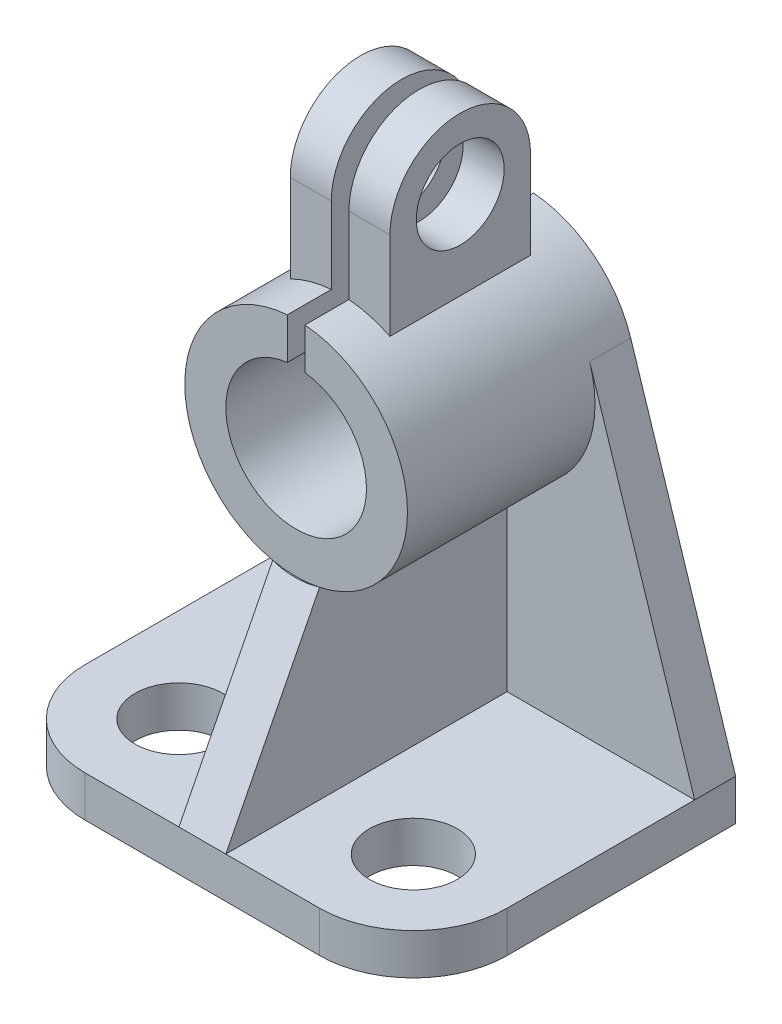
from build123d import *

# Parameters (mm, degrees)
SKETCH1_W                  = 72
SKETCH1_H                  = 7
BOSS_EXTRUDE1_DEPTH        = 55
BOSS_EXTRUDE2_DEPTH        = 7
BOSS_EXTRUDE3_DEPTH        = 39
BOSS_EXTRUDE4_START        = 7.5
BOSS_EXTRUDE4_DEPTH        = 24
BOSS_EXTRUDE5_DEPTH        = 55
FILLET3_RADIUS             = 12
FILLET3_LENGTH             = 7
FILLET4_RADIUS             = 12
FILLET4_LENGTH             = 7
CUT_EXTRUDE1_DEPTH         = 55
F_12_0MM_DOWEL_HOLE1_D     = 15
F_12_0MM_DOWEL_HOLE1_DEPTH = 30
F_12_0MM_DOWEL_HOLE1_TIP   = 4.506454643
FILLET5_R                  = 16
F_12_0MM_DOWEL_HOLE2_D     = 15
F_12_0MM_DOWEL_HOLE2_DEPTH = 30
F_12_0MM_DOWEL_HOLE2_TIP   = 4.506454643


with BuildPart() as part:
    # Sketch1 → Boss-Extrude1 (new body)
    with BuildSketch(Plane.XY):
        with Locations((0, 3.5)):
            Rectangle(SKETCH1_W, SKETCH1_H)
    extrude(amount=BOSS_EXTRUDE1_DEPTH)

    # Sketch1<3> → Boss-Extrude2 (add)
    with BuildSketch(Plane.XY):
        with BuildLine():
            Line((36, 7), (18.091261695, 62.805708421))
            ThreePointArc((18.091261695, 62.805708421), (16.449943687, 47.492142581), (4, 38.425824379))
            Line((4, 38.425824379), (4, 7))
            Line((4, 7), (36, 7))
        make_face()
        with BuildLine():
            ThreePointArc((-4, 38.425824379), (-16.449943687, 47.492142581), (-18.091261695, 62.805708421))
            Line((-18.091261695, 62.805708421), (-36, 7))
            Line((-36, 7), (-4, 7))
            Line((-4, 7), (-4, 38.425824379))
        make_face()
    extrude(amount=BOSS_EXTRUDE2_DEPTH)

    # Sketch1<4> → Boss-Extrude3 (add)
    with BuildSketch(Plane.XY):
        with BuildLine():
            ThreePointArc((-1.5, 68.9058809), (0, 45), (1.5, 68.9058809))
            Line((1.5, 68.9058809), (1.5, 75.940696925))
            ThreePointArc((1.5, 75.940696925), (0, 38), (-1.5, 75.940696925))
            Line((-1.5, 75.940696925), (-1.5, 68.9058809))
        make_face()
    extrude(amount=BOSS_EXTRUDE3_DEPTH)

    # Sketch1<5> → Boss-Extrude4 (add)
    with BuildSketch(Plane.XY.offset(BOSS_EXTRUDE4_START)):
        with BuildLine():
            Line((1.5, 101), (1.5, 75.940696925))
            ThreePointArc((1.5, 75.940696925), (5.093989215, 75.30440586), (8.5, 73.992645468))
            Line((8.5, 73.992645468), (8.5, 101))
            Line((8.5, 101), (1.5, 101))
        make_face()
        with BuildLine():
            ThreePointArc((-8.5, 73.992645468), (-5.093989215, 75.30440586), (-1.5, 75.940696925))
            Line((-1.5, 75.940696925), (-1.5, 101))
            Line((-1.5, 101), (-8.5, 101))
            Line((-8.5, 101), (-8.5, 73.992645468))
        make_face()
    extrude(amount=BOSS_EXTRUDE4_DEPTH)

    # Sketch1<6> → Boss-Extrude5 (add)
    with BuildSketch(Plane.XY):
        with BuildLine():
            ThreePointArc((4, 38.425824379), (0, 38), (-4, 38.425824379))
            Line((-4, 38.425824379), (-4, 7))
            Line((-4, 7), (4, 7))
            Line((4, 7), (4, 38.425824379))
        make_face()
    extrude(amount=BOSS_EXTRUDE5_DEPTH)

    # Fillet3: full round fillet: the end face becomes a half cylinder, R = half its width
    fillet3_face = Plane((5, 101, 19.5), x_dir=(1, 0, 0), z_dir=(0, 1, 0))  # on the end face: x along it, z out of the body
    fillet3_slab = fillet3_face.offset(-FILLET3_RADIUS / 2) * Box(FILLET3_LENGTH, 2 * FILLET3_RADIUS, FILLET3_RADIUS, mode=Mode.PRIVATE)  # the body's end, R deep
    fillet3_round = Plane((5, 89, 19.5), x_dir=(0, 1, 0), z_dir=(1, 0, 0)) * Cylinder(FILLET3_RADIUS, FILLET3_LENGTH, mode=Mode.PRIVATE)  # its axis R under the face
    add(fillet3_slab - fillet3_round, mode=Mode.SUBTRACT)

    # Fillet4: full round fillet: the end face becomes a half cylinder, R = half its width
    fillet4_face = Plane((-5, 101, 19.5), x_dir=(-1, 0, 0), z_dir=(0, 1, 0))  # on the end face: x along it, z out of the body
    fillet4_slab = fillet4_face.offset(-FILLET4_RADIUS / 2) * Box(FILLET4_LENGTH, 2 * FILLET4_RADIUS, FILLET4_RADIUS, mode=Mode.PRIVATE)  # the body's end, R deep
    fillet4_round = Plane((-5, 89, 19.5), x_dir=(0, 1, 0), z_dir=(-1, 0, 0)) * Cylinder(FILLET4_RADIUS, FILLET4_LENGTH, mode=Mode.PRIVATE)  # its axis R under the face
    add(fillet4_slab - fillet4_round, mode=Mode.SUBTRACT)

    # Sketch2 → Cut-Extrude1 (cut)
    with BuildSketch(Plane(origin=(4, 0, 0), x_dir=(0, 0, -1), z_dir=(1, 0, 0))):
        Polygon((-39, 38.425824379), (-55, 7), (-55, 38.425824379), align=None)
    extrude(amount=-CUT_EXTRUDE1_DEPTH, mode=Mode.SUBTRACT)

    # Ø12.0mm Dowel Hole1
    with Locations(Plane(origin=(8.5, 89, 19.5), x_dir=(0, 1, 0), z_dir=(1, 0, 0))):
        with Locations((0, 0)):
            Hole(F_12_0MM_DOWEL_HOLE1_D / 2, depth=F_12_0MM_DOWEL_HOLE1_DEPTH)
            with Locations((0, 0, -(F_12_0MM_DOWEL_HOLE1_DEPTH + F_12_0MM_DOWEL_HOLE1_TIP / 2))):  # 118° drill point
                Cone(0, F_12_0MM_DOWEL_HOLE1_D / 2, F_12_0MM_DOWEL_HOLE1_TIP, mode=Mode.SUBTRACT)

    # Fillet5
    fillet5_edges = [part.edges().sort_by_distance(p)[0] for p in [
        (-36, 3.5, 55),
        (36, 3.5, 55),
    ]]
    fillet(fillet5_edges, radius=FILLET5_R)

    # Ø12.0mm Dowel Hole2
    with Locations(Plane(origin=(20, 7, 39), x_dir=(0, 0, 1), z_dir=(0, 1, 0))):
        with Locations((0, 0), (0, -40)):
            Hole(F_12_0MM_DOWEL_HOLE2_D / 2, depth=F_12_0MM_DOWEL_HOLE2_DEPTH)
            with Locations((0, 0, -(F_12_0MM_DOWEL_HOLE2_DEPTH + F_12_0MM_DOWEL_HOLE2_TIP / 2))):  # 118° drill point
                Cone(0, F_12_0MM_DOWEL_HOLE2_D / 2, F_12_0MM_DOWEL_HOLE2_TIP, mode=Mode.SUBTRACT)


solid = part.part
